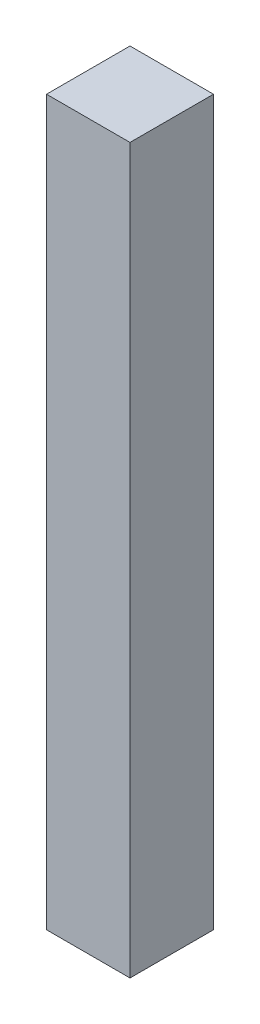
from build123d import *

# Parameters (mm, degrees)
SKETCH1_W           = 38.1
SKETCH1_H           = 38.1
BOSS_EXTRUDE1_DEPTH = 330.2


with BuildPart() as part:
    # Sketch1 → Boss-Extrude1 (new body)
    with BuildSketch(Plane(origin=(0, 0, 0), x_dir=(1, 0, 0), z_dir=(0, 1, 0))):
        with Locations((19.05, -19.05)):
            Rectangle(SKETCH1_W, SKETCH1_H)
    extrude(amount=BOSS_EXTRUDE1_DEPTH)


solid = part.part
